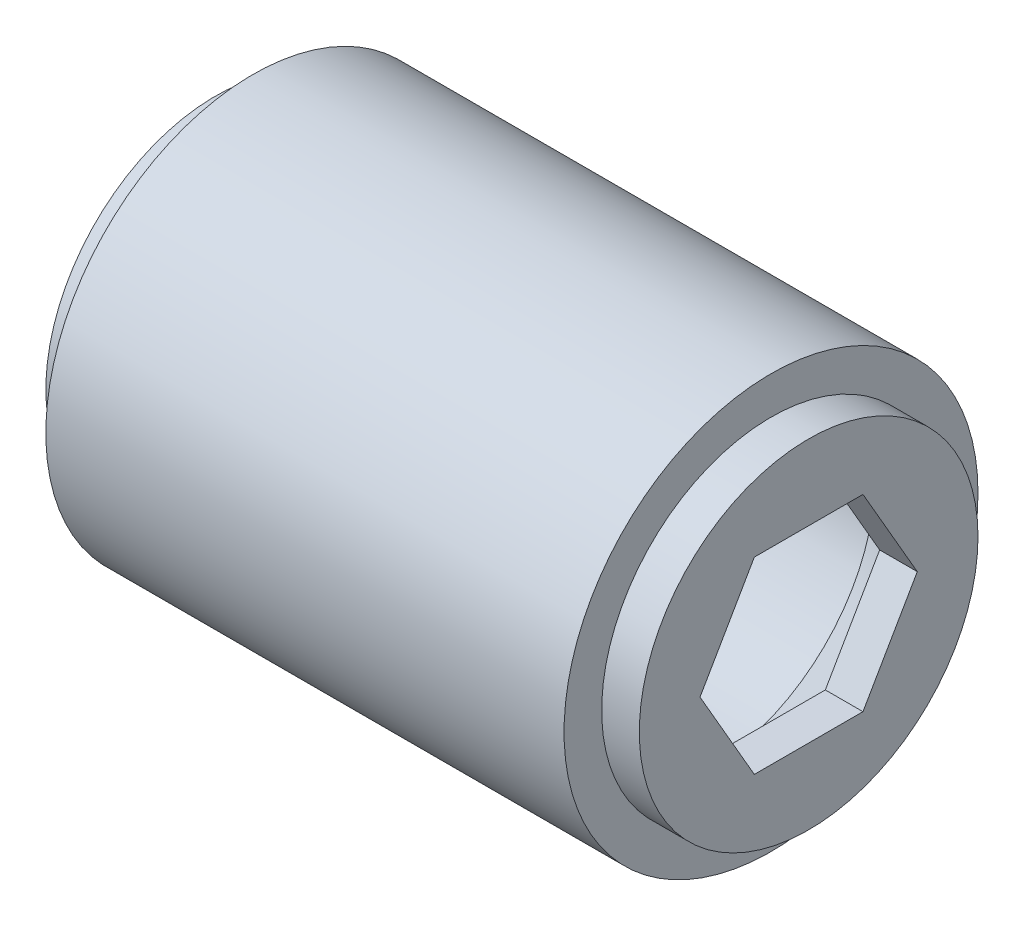
from build123d import *

# Parameters (mm, degrees)
CUT_EXTRUDE1_DEPTH = 36.167763648


with BuildPart() as part:
    # Sketch4 → Revolve2 (revolve)
    with BuildSketch(Plane.XY, mode=Mode.PRIVATE) as revolve2_sk:
        Polygon((-29.54, 11), (-2, 11), (-2, 9), (0, 9), (0, 7), (0, 0), (-2, 0), (-2, 7), (-5.464101615, 9), (-26.075898385, 9), (-29.54, 7), (-29.54, 0), (-31.54, 0), (-31.54, 7), (-31.54, 9), (-29.54, 9), align=None)
    revolve(revolve2_sk.sketch.rotate(Axis((0, 0, 0), (-1, 0, 0)), 90), axis=Axis((0, 0, 0), (-1, 0, 0)))

    # Sketch5 → Cut-Extrude1 (cut, through all)
    with BuildSketch(Plane.ZY.offset(31.54)):
        Polygon((-2.886751346, 5), (-5.773502692, 0), (-2.886751346, -5), (2.886751346, -5), (5.773502692, 0), (2.886751346, 5), align=None)
    extrude(amount=-CUT_EXTRUDE1_DEPTH, mode=Mode.SUBTRACT)


solid = part.part
